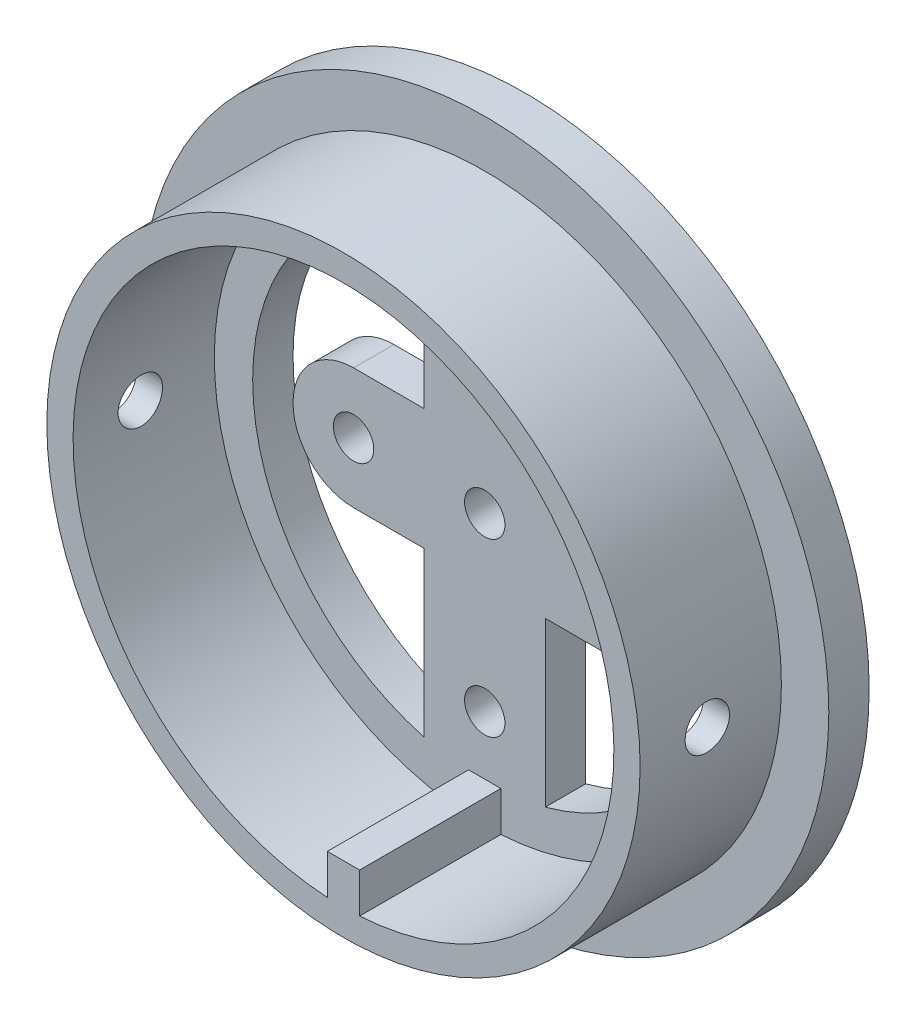
from build123d import *

# Parameters (mm, degrees)
SKETCH1_R               = 14.7
SKETCH1_R_2             = 13.4
BOSS_EXTRUDE1_DEPTH     = 7
SKETCH2_W               = 1.6
SKETCH2_H               = 2
BOSS_EXTRUDE2_DEPTH     = 7
CUT_EXTRUDE1_DEPTH      = 22.935815462
CUT_EXTRUDE1_DEPTH_BACK = 22.935815462
SKETCH3_R               = 1.1
SKETCH4_R               = 17.05
SKETCH4_R_2             = 11.5
BOSS_EXTRUDE3_DEPTH     = 2
BOSS_EXTRUDE4_DEPTH     = 2
CUT_EXTRUDE2_REACH      = 27.108
SKETCH6_R               = 1


with BuildPart() as part:
    # Sketch1 → Boss-Extrude1 (new body)
    with BuildSketch(Plane.XY):
        Circle(SKETCH1_R)
        Circle(SKETCH1_R_2, mode=Mode.SUBTRACT)
    extrude(amount=BOSS_EXTRUDE1_DEPTH)

    # Sketch2 → Boss-Extrude2 (add)
    with BuildSketch(Plane.XY):
        with Locations((0, -12.4)):
            Rectangle(SKETCH2_W, SKETCH2_H)
    extrude(amount=BOSS_EXTRUDE2_DEPTH)

    # Sketch3 → Cut-Extrude1 (cut, two sides: drawn at the far end of the back side and taken through both)
    with BuildSketch(Plane(origin=(0, 0, 0), x_dir=(0, 0, -1), z_dir=(1, 0, 0)).offset(-CUT_EXTRUDE1_DEPTH_BACK)):
        with Locations((-3.67, 0)):
            Circle(SKETCH3_R)
    extrude(amount=CUT_EXTRUDE1_DEPTH + CUT_EXTRUDE1_DEPTH_BACK, mode=Mode.SUBTRACT)

    # Sketch4 → Boss-Extrude3 (add)
    with BuildSketch(Plane.XY):
        Circle(SKETCH4_R)
        Circle(SKETCH4_R_2, mode=Mode.SUBTRACT)
    extrude(amount=-BOSS_EXTRUDE3_DEPTH)

    # Sketch5 → Boss-Extrude4 (add)
    with BuildSketch(Plane.XY):
        with BuildLine():
            Line((-6.5, -3), (-3, -3))
            Line((-3, -3), (-3, -11.5))
            Line((-3, -11.5), (3, -11.5))
            Line((3, -11.5), (3, -3))
            Line((3, -3), (6.5, -3))
            ThreePointArc((6.5, -3), (9.5, 0), (6.5, 3))
            Line((6.5, 3), (3, 3))
            Line((3, 3), (3, 11.5))
            Line((3, 11.5), (0, 11.5))
            Line((0, 11.5), (-3, 11.5))
            Line((-3, 11.5), (-3, 3))
            Line((-3, 3), (-6.5, 3))
            ThreePointArc((-6.5, 3), (-9.5, 0), (-6.5, -3))
        make_face()
    extrude(amount=-BOSS_EXTRUDE4_DEPTH)

    # Sketch6 → Cut-Extrude2 (cut, up to next)
    with BuildSketch(Plane.XY, mode=Mode.PRIVATE) as cut_extrude2_sk1:
        Circle(SKETCH6_R)
    cut_extrude2_tool1 = extrude(cut_extrude2_sk1.sketch, amount=-CUT_EXTRUDE2_REACH, mode=Mode.PRIVATE) & part.part
    # Sketch6 → Cut-Extrude2 (cut, up to next)
    with BuildSketch(Plane.XY, mode=Mode.PRIVATE) as cut_extrude2_sk2:
        with Locations((6.5, 0)):
            Circle(SKETCH6_R)
    cut_extrude2_tool2 = extrude(cut_extrude2_sk2.sketch, amount=-CUT_EXTRUDE2_REACH, mode=Mode.PRIVATE) & part.part
    # Sketch6 → Cut-Extrude2 (cut, up to next)
    with BuildSketch(Plane.XY, mode=Mode.PRIVATE) as cut_extrude2_sk3:
        with Locations((-6.5, 0)):
            Circle(SKETCH6_R)
    cut_extrude2_tool3 = extrude(cut_extrude2_sk3.sketch, amount=-CUT_EXTRUDE2_REACH, mode=Mode.PRIVATE) & part.part
    # Sketch6 → Cut-Extrude2 (cut, up to next)
    with BuildSketch(Plane.XY, mode=Mode.PRIVATE) as cut_extrude2_sk4:
        with Locations((0, 8.5)):
            Circle(SKETCH6_R)
    cut_extrude2_tool4 = extrude(cut_extrude2_sk4.sketch, amount=-CUT_EXTRUDE2_REACH, mode=Mode.PRIVATE) & part.part
    # Sketch6 → Cut-Extrude2 (cut, up to next)
    with BuildSketch(Plane.XY, mode=Mode.PRIVATE) as cut_extrude2_sk5:
        with Locations((0, -8.5)):
            Circle(SKETCH6_R)
    cut_extrude2_tool5 = extrude(cut_extrude2_sk5.sketch, amount=-CUT_EXTRUDE2_REACH, mode=Mode.PRIVATE) & part.part
    add(cut_extrude2_tool1.solids().sort_by_distance((0, 0, 0))[0], mode=Mode.SUBTRACT)
    add(cut_extrude2_tool2.solids().sort_by_distance((6.5, 0, 0))[0], mode=Mode.SUBTRACT)
    add(cut_extrude2_tool3.solids().sort_by_distance((-6.5, 0, 0))[0], mode=Mode.SUBTRACT)
    add(cut_extrude2_tool4.solids().sort_by_distance((0, 8.5, 0))[0], mode=Mode.SUBTRACT)
    add(cut_extrude2_tool5.solids().sort_by_distance((0, -8.5, 0))[0], mode=Mode.SUBTRACT)


solid = part.part
